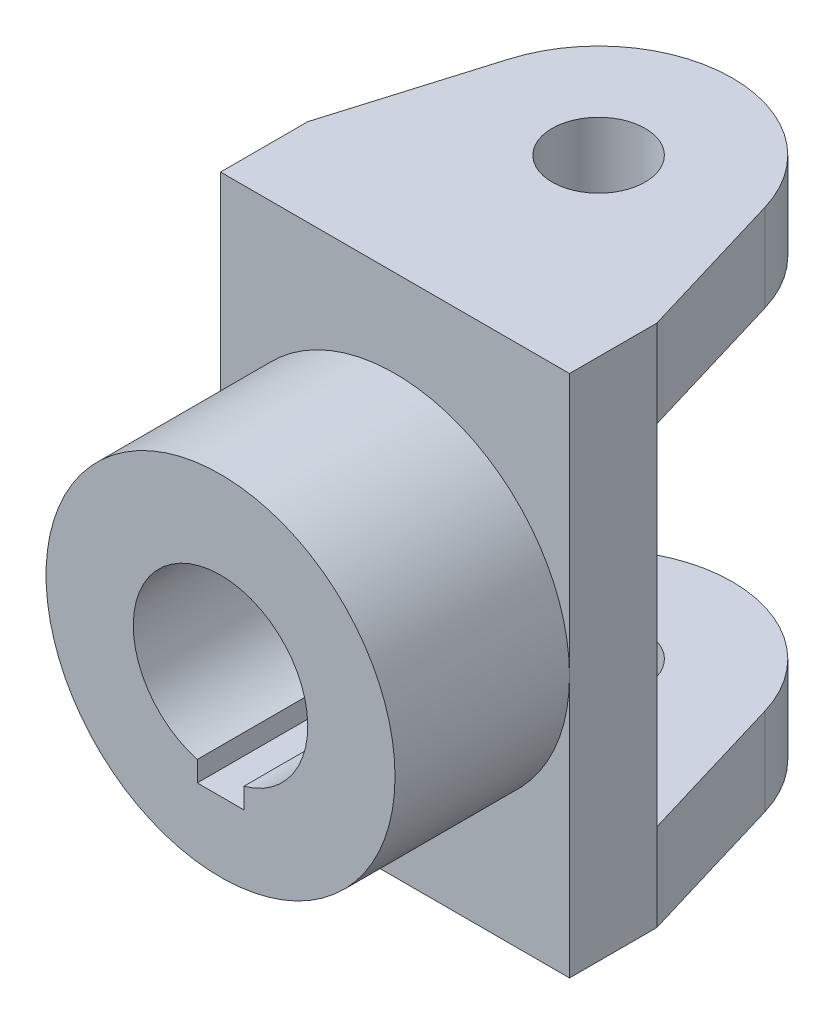
from build123d import *

# Parameters (mm, degrees)
SKETCH1_R           = 30
BOSS_EXTRUDE1_DEPTH = 30
SKETCH2_W           = 60
SKETCH2_H           = 90
BOSS_EXTRUDE2_DEPTH = 15
SKETCH3_R           = 8
BOSS_EXTRUDE3_DEPTH = 15


with BuildPart() as part:
    # Sketch1 → Boss-Extrude1 (new body)
    with BuildSketch(Plane.XY):
        Circle(SKETCH1_R)
        with BuildLine():
            Line((-4, -14.456832295), (-4, -17.956832295))
            Line((-4, -17.956832295), (4, -17.956832295))
            Line((4, -17.956832295), (4, -14.456832295))
            ThreePointArc((4, -14.456832295), (0, 15), (-4, -14.456832295))
        make_face(mode=Mode.SUBTRACT)
    extrude(amount=-BOSS_EXTRUDE1_DEPTH)

    # Sketch2 → Boss-Extrude2 (add)
    with BuildSketch(Plane(origin=(0, 0, -30), x_dir=(-1, 0, 0), z_dir=(0, 0, -1))):
        Rectangle(SKETCH2_W, SKETCH2_H)
    extrude(amount=BOSS_EXTRUDE2_DEPTH)

    # Sketch3 → Boss-Extrude3 (add)
    with BuildSketch(Plane(origin=(0, 45, 0), x_dir=(1, 0, 0), z_dir=(0, 1, 0))):
        with BuildLine():
            Line((22.03289839, 71.599347585), (30, 45))
            Line((30, 45), (30, 30))
            Line((30, 30), (-30, 30))
            Line((-30, 30), (-30, 45))
            Line((-30, 45), (-22.03289839, 71.599347585))
            ThreePointArc((-22.03289839, 71.599347585), (0, 88), (22.03289839, 71.599347585))
        make_face()
        with Locations(Location((0, 65, 0), (0, 0, 180))):
            Circle(SKETCH3_R, mode=Mode.SUBTRACT)
    boss_extrude3 = extrude(amount=-BOSS_EXTRUDE3_DEPTH)

    # Mirror1: Boss-Extrude3 across plane
    add(boss_extrude3.mirror(Plane.ZX))


solid = part.part
